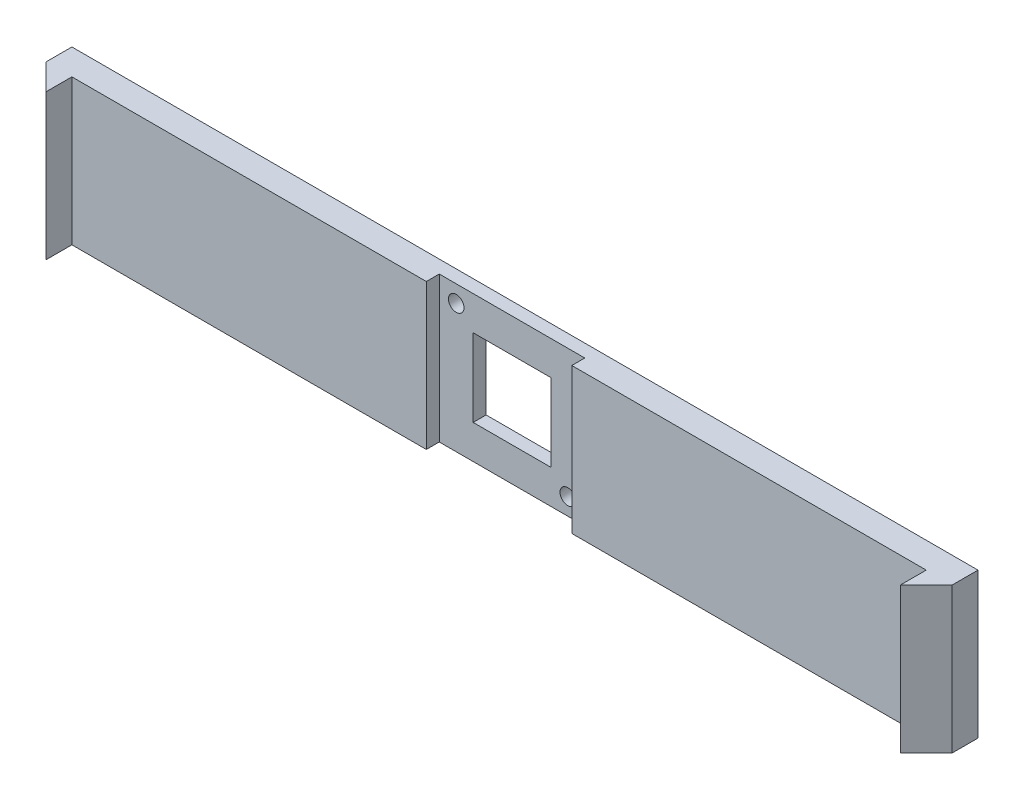
from build123d import *

# Parameters (mm, degrees)
SKETCH1_W           = 330
SKETCH1_H           = 56.2
BOSS_EXTRUDE1_DEPTH = 10
SKETCH2_W           = 56.2
SKETCH2_H           = 56.2
CUT_EXTRUDE1_DEPTH  = 5
SKETCH3_W           = 10
SKETCH3_H           = 56.2
BOSS_EXTRUDE2_DEPTH = 10
SKETCH4_W           = 10
SKETCH4_H           = 56.2
BOSS_EXTRUDE3_DEPTH = 10
CUT_EXTRUDE2_DEPTH  = 56.2
SKETCH6_W           = 10
SKETCH6_H           = 56.2
BOSS_EXTRUDE4_DEPTH = 10
SKETCH7_W           = 10
SKETCH7_H           = 56.2
BOSS_EXTRUDE5_DEPTH = 10
CUT_EXTRUDE3_DEPTH  = 56.2
SKETCH9_W           = 30
SKETCH9_H           = 30
CUT_EXTRUDE4_DEPTH  = 5
SKETCH10_R          = 3
CUT_EXTRUDE5_DEPTH  = 5


with BuildPart() as part:
    # Sketch1 → Boss-Extrude1 (new body)
    with BuildSketch(Plane.XY):
        Rectangle(SKETCH1_W, SKETCH1_H)
    extrude(amount=BOSS_EXTRUDE1_DEPTH)

    # Sketch2 → Cut-Extrude1 (cut)
    with BuildSketch(Plane.XY.offset(10)):
        Rectangle(SKETCH2_W, SKETCH2_H)
    extrude(amount=-CUT_EXTRUDE1_DEPTH, mode=Mode.SUBTRACT)

    # Sketch3 → Boss-Extrude2 (add)
    with BuildSketch(Plane(origin=(165, 0, 0), x_dir=(0, 0, -1), z_dir=(1, 0, 0))):
        with Locations((-5, 0)):
            Rectangle(SKETCH3_W, SKETCH3_H)
    extrude(amount=BOSS_EXTRUDE2_DEPTH)

    # Sketch4 → Boss-Extrude3 (add)
    with BuildSketch(Plane.XY.offset(10)):
        with Locations((170, 0)):
            Rectangle(SKETCH4_W, SKETCH4_H)
    extrude(amount=BOSS_EXTRUDE3_DEPTH)

    # Sketch5 → Cut-Extrude2 (cut)
    with BuildSketch(Plane(origin=(0, 28.1, 0), x_dir=(1, 0, 0), z_dir=(0, 1, 0))):
        Polygon((165, -20), (175, -10), (175, -20), align=None)
    extrude(amount=-CUT_EXTRUDE2_DEPTH, mode=Mode.SUBTRACT)

    # Sketch6 → Boss-Extrude4 (add)
    with BuildSketch(Plane.ZY.offset(165)):
        with Locations((5, 0)):
            Rectangle(SKETCH6_W, SKETCH6_H)
    extrude(amount=BOSS_EXTRUDE4_DEPTH)

    # Sketch7 → Boss-Extrude5 (add)
    with BuildSketch(Plane.XY.offset(10)):
        with Locations((-170, 0)):
            Rectangle(SKETCH7_W, SKETCH7_H)
    extrude(amount=BOSS_EXTRUDE5_DEPTH)

    # Sketch8 → Cut-Extrude3 (cut)
    with BuildSketch(Plane(origin=(0, 28.1, 0), x_dir=(1, 0, 0), z_dir=(0, 1, 0))):
        Polygon((-165, -20), (-175, -10), (-175, -20), align=None)
    extrude(amount=-CUT_EXTRUDE3_DEPTH, mode=Mode.SUBTRACT)

    # Sketch9 → Cut-Extrude4 (cut)
    with BuildSketch(Plane.XY.offset(5)):
        Rectangle(SKETCH9_W, SKETCH9_H)
    extrude(amount=-CUT_EXTRUDE4_DEPTH, mode=Mode.SUBTRACT)

    # Sketch10 → Cut-Extrude5 (cut)
    with BuildSketch(Plane.XY.offset(5)):
        with Locations((-21.55, 21.55)):
            Circle(SKETCH10_R)
        with Locations((21.55, -21.55)):
            Circle(SKETCH10_R)
    extrude(amount=-CUT_EXTRUDE5_DEPTH, mode=Mode.SUBTRACT)


solid = part.part
